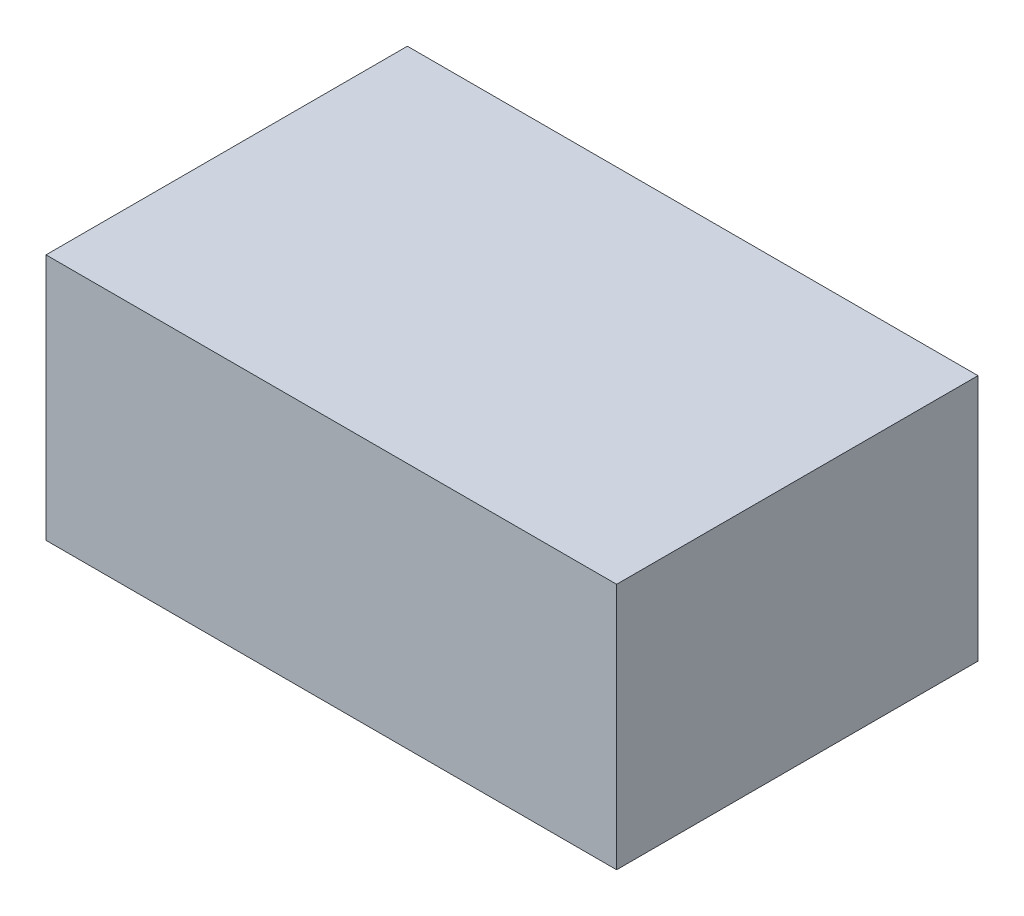
from build123d import *

# Parameters (mm, degrees)
SKETCH_1_W      = 150
SKETCH_1_H      = 65
EXTRUDE_1_DEPTH = 95
SKETCH_2_W      = 1
SKETCH_2_H      = 7


with BuildPart() as part:
    # 草图1 → 拉伸1 (new body)
    with BuildSketch(Plane.XY):
        Rectangle(SKETCH_1_W, SKETCH_1_H)
    extrude(amount=EXTRUDE_1_DEPTH)

    # 扫描1: sweep along a path in 草图3
    with BuildLine(Plane(origin=(0, 19, 0), x_dir=(-1, 0, 0), z_dir=(0, 1, 0))) as sweep_1_path:
        Line((59.5, 0), (59.5, -4))
        Line((59.5, -4), (48.5, -4))
    # 草图2 → 扫描1 (sweep)
    with BuildSketch(Plane(origin=(0, 0, 0), x_dir=(-1, 0, 0), z_dir=(0, 0, -1))):
        with Locations((59.5, 22)):
            Rectangle(SKETCH_2_W, SKETCH_2_H)
    sweep_1 = sweep(path=sweep_1_path.line, transition=Transition.RIGHT)

    # 镜向1: 扫描1 across plane
    add(sweep_1.mirror(Plane.ZX))


solid = part.part
